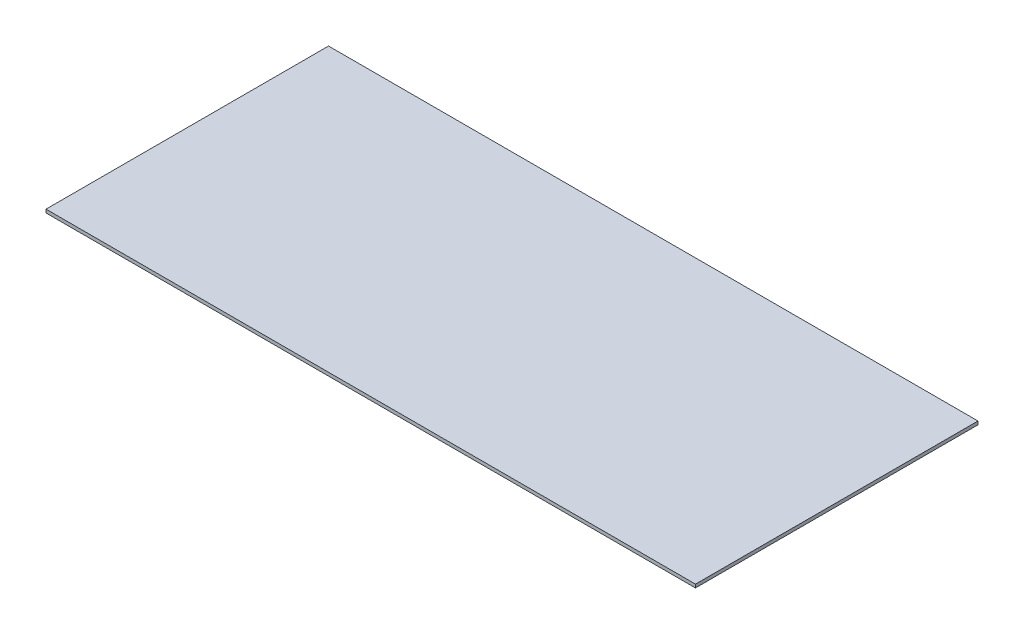
from build123d import *

# Parameters (mm, degrees)
SKETCH1_W           = 388.5
SKETCH1_H           = 169
BOSS_EXTRUDE1_DEPTH = 2


with BuildPart() as part:
    # Sketch1 → Boss-Extrude1 (new body)
    with BuildSketch(Plane(origin=(0, 0, 0), x_dir=(1, 0, 0), z_dir=(0, 1, 0))):
        Rectangle(SKETCH1_W, SKETCH1_H)
    extrude(amount=BOSS_EXTRUDE1_DEPTH)


solid = part.part
